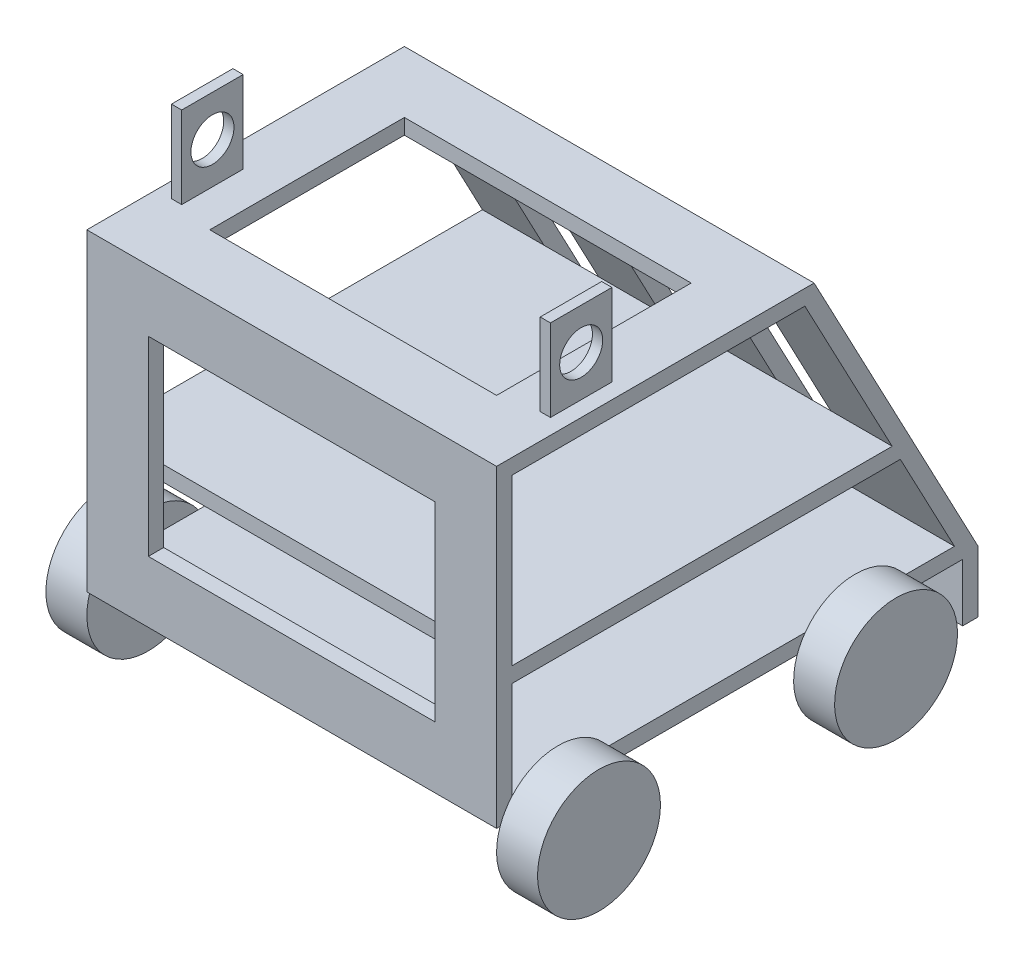
from build123d import *

# Parameters (mm, degrees)
SKETCH2_W           = 38.1
SKETCH2_H           = 50.8
SKETCH2_R           = 13.335
BOSS_EXTRUDE2_DEPTH = 3.175
SKETCH4_W           = 38.1
SKETCH4_H           = 50.8
SKETCH4_R           = 13.335
BOSS_EXTRUDE3_DEPTH = 3.175
BOSS_EXTRUDE4_DEPTH = 127
CUT_EXTRUDE3_DEPTH  = 127
BOSS_EXTRUDE7_DEPTH = 127
SKETCH16_R          = 38.1
BOSS_EXTRUDE8_DEPTH = 25.4
CUT_EXTRUDE6_REACH  = 522.886
SKETCH19_W          = 33.866666667
SKETCH19_H          = 115.824
SKETCH19_W_2        = 33.866666666
SKETCH20_W          = 177.8
SKETCH20_H          = 120.65
CUT_EXTRUDE7_DEPTH  = 34.925
SKETCH22_W          = 177.8
SKETCH22_H          = 118.188552156
CUT_EXTRUDE8_DEPTH  = 9.525


with BuildPart() as part:
    # Sketch2 → Boss-Extrude2 (new, symmetric)
    with BuildSketch(Plane(origin=(63.5, 0, 0), x_dir=(0, 0, -1), z_dir=(1, 0, 0))):
        Rectangle(SKETCH2_W, SKETCH2_H)
        Circle(SKETCH2_R, mode=Mode.SUBTRACT)
    extrude(amount=BOSS_EXTRUDE2_DEPTH, both=True)



with BuildPart() as body_2:
    # Sketch4 → Boss-Extrude3 (new, symmetric)
    with BuildSketch(Plane(origin=(292.1, 0, -263.652), x_dir=(0, 0, 1), z_dir=(-1, 0, 0))):
        with Locations((263.652, 0)):
            Rectangle(SKETCH4_W, SKETCH4_H)
        with Locations(Location((263.652, 0, 0), (0, 0, 180))):
            Circle(SKETCH4_R, mode=Mode.SUBTRACT)
    extrude(amount=BOSS_EXTRUDE3_DEPTH, both=True)


with BuildPart() as part_1:
    add(part.part)

    add(body_2.part)  # Boss-Extrude4 merges body 2
    # Sketch6 → Boss-Extrude4 (add, symmetric)
    with BuildSketch(Plane(origin=(177.8, 0, 0), x_dir=(0, 0, -1), z_dir=(1, 0, 0))):
        Polygon((-19.05, -25.4), (-61.976, -25.4), (-61.976, -255.524), (236.474, -255.524), (236.474, -217.424), (134.874, -25.4), (19.05, -25.4), align=None)
    extrude(amount=BOSS_EXTRUDE4_DEPTH, both=True)

    # Sketch13 → Cut-Extrude3 (cut, symmetric)
    with BuildSketch(Plane(origin=(177.8, 0, 0), x_dir=(0, 0, -1), z_dir=(1, 0, 0))):
        Polygon((-52.451, -34.925), (129.137596743, -34.925), (226.949, -219.788552156), (226.949, -255.524), (-61.976, -255.524), (-61.976, -219.788552156), (-52.451, -219.788552156), align=None)
    extrude(amount=CUT_EXTRUDE3_DEPTH, both=True, mode=Mode.SUBTRACT)

    # Sketch14 → Boss-Extrude7 (add, symmetric)
    with BuildSketch(Plane(origin=(177.8, 0, 0), x_dir=(0, 0, -1), z_dir=(1, 0, 0))):
        Polygon((226.949, -219.788552156), (-52.451, -219.788552156), (-52.451, -210.263552156), (221.90931746, -210.263552156), align=None)
        Polygon((-52.451, -146.763552156), (188.311433862, -146.763552156), (183.271751323, -137.238552156), (-52.451, -137.238552156), align=None)
    extrude(amount=BOSS_EXTRUDE7_DEPTH, both=True)

    # Sketch16 → Boss-Extrude8 (add)
    with BuildSketch(Plane(origin=(304.8, 0, 0), x_dir=(0, 0, -1), z_dir=(1, 0, 0))):
        with Locations(Location((-23.876, -232.488552156, 0), (0, 0, 160.528779366))):
            Circle(SKETCH16_R)
        with Locations(Location((160.274, -232.488552156, 0), (0, 0, 160.528779366))):
            Circle(SKETCH16_R)
    boss_extrude8 = extrude(amount=BOSS_EXTRUDE8_DEPTH)

    # Mirror1: Boss-Extrude8 across plane
    add(boss_extrude8.mirror(Plane(origin=(177.8, 0, 0), x_dir=(0, 0, 1), z_dir=(1, 0, 0))))

    # Cut-Extrude6: up to this plane
    cut_extrude6_end = Plane(origin=(50.8, -34.925, -129.137596743), z_dir=(0, 0.46767282988430103, -0.8839016484813284))
    # Sketch19 → Cut-Extrude6 (cut, up to the surface)
    with BuildSketch(Plane(origin=(0, 0, -236.474), x_dir=(-1, 0, 0), z_dir=(0, 0, -1)), mode=Mode.PRIVATE) as cut_extrude6_sk1:
        with Locations((-249.766666666, -121.412)):
            Rectangle(SKETCH19_W, SKETCH19_H)
    cut_extrude6_tool1 = split(extrude(cut_extrude6_sk1.sketch, amount=-CUT_EXTRUDE6_REACH, mode=Mode.PRIVATE), bisect_by=cut_extrude6_end, keep=Keep.BOTH, mode=Mode.PRIVATE)
    add(cut_extrude6_tool1.solids().sort_by_distance((249.766667, -121.412, -236.474))[0], mode=Mode.SUBTRACT)
    # Sketch19 → Cut-Extrude6 (cut, up to the surface)
    with BuildSketch(Plane(origin=(0, 0, -236.474), x_dir=(-1, 0, 0), z_dir=(0, 0, -1)), mode=Mode.PRIVATE) as cut_extrude6_sk2:
        with Locations((-177.8, -121.412)):
            Rectangle(SKETCH19_W_2, SKETCH19_H)
    cut_extrude6_tool2 = split(extrude(cut_extrude6_sk2.sketch, amount=-CUT_EXTRUDE6_REACH, mode=Mode.PRIVATE), bisect_by=cut_extrude6_end, keep=Keep.BOTH, mode=Mode.PRIVATE)
    add(cut_extrude6_tool2.solids().sort_by_distance((177.8, -121.412, -236.474))[0], mode=Mode.SUBTRACT)
    # Sketch19 → Cut-Extrude6 (cut, up to the surface)
    with BuildSketch(Plane(origin=(0, 0, -236.474), x_dir=(-1, 0, 0), z_dir=(0, 0, -1)), mode=Mode.PRIVATE) as cut_extrude6_sk3:
        with Locations((-105.833333334, -121.412)):
            Rectangle(SKETCH19_W, SKETCH19_H)
    cut_extrude6_tool3 = split(extrude(cut_extrude6_sk3.sketch, amount=-CUT_EXTRUDE6_REACH, mode=Mode.PRIVATE), bisect_by=cut_extrude6_end, keep=Keep.BOTH, mode=Mode.PRIVATE)
    add(cut_extrude6_tool3.solids().sort_by_distance((105.833333, -121.412, -236.474))[0], mode=Mode.SUBTRACT)

    # Sketch20 → Cut-Extrude7 (cut)
    with BuildSketch(Plane(origin=(0, 0, 0), x_dir=(1, 0, 0), z_dir=(0, 1, 0))):
        with Locations((177.8, 36.449)):
            Rectangle(SKETCH20_W, SKETCH20_H)
    extrude(amount=-CUT_EXTRUDE7_DEPTH, mode=Mode.SUBTRACT)

    # Sketch22 → Cut-Extrude8 (cut)
    with BuildSketch(Plane.XY.offset(61.976)):
        with Locations((177.8, -122.594276078)):
            Rectangle(SKETCH22_W, SKETCH22_H)
    extrude(amount=-CUT_EXTRUDE8_DEPTH, mode=Mode.SUBTRACT)


solid = part_1.part
